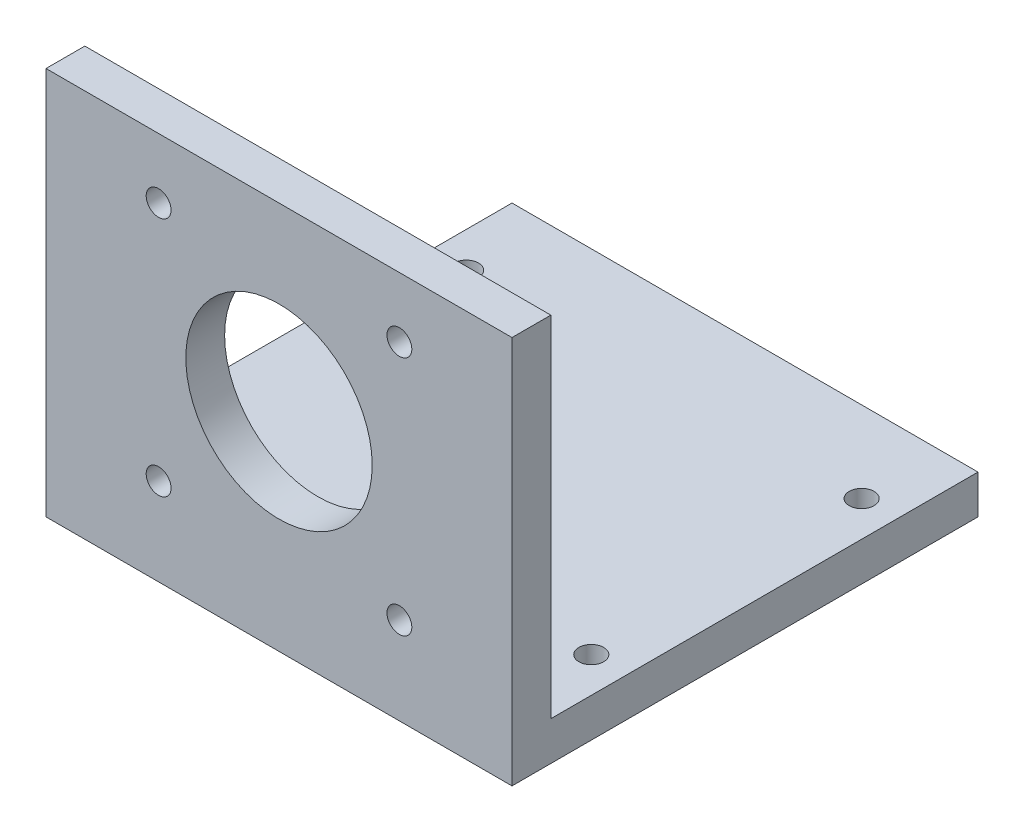
from build123d import *

# Parameters (mm, degrees)
EXTRUDE_1_DEPTH = 60
HOLE_WIZARD_2_D = 24
HOLE_WIZARD_3_D = 3.2
HOLE_WIZARD_4_D = 3.2


with BuildPart() as part:
    # 草图1 → 凸台-拉伸1 (new body)
    with BuildSketch(Plane(origin=(0, 0, 0), x_dir=(0, 0, -1), z_dir=(1, 0, 0))):
        Polygon((0, 0), (0, 50), (5, 50), (5, 5), (60, 5), (60, 0), align=None)
    extrude(amount=EXTRUDE_1_DEPTH)

    # 孔2 (through all)
    with Locations(Plane.XY):
        with Locations((30, 26.75)):
            Hole(HOLE_WIZARD_2_D / 2)

    # 孔3 (through all)
    with Locations(Plane.XY):
        with Locations((14.5, 42.25), (45.5, 42.25), (45.5, 11.25), (14.5, 11.25)):
            Hole(HOLE_WIZARD_3_D / 2)

    # 孔4 (through all)
    with Locations(Plane(origin=(0, 5, 0), x_dir=(1, 0, 0), z_dir=(0, 1, 0))):
        with Locations((55.459259259, 14.749042146), (55.459259259, 49.557471264), (4.540740741, 14.749042146), (4.540740741, 49.557471264)):
            Hole(HOLE_WIZARD_4_D / 2)


solid = part.part
